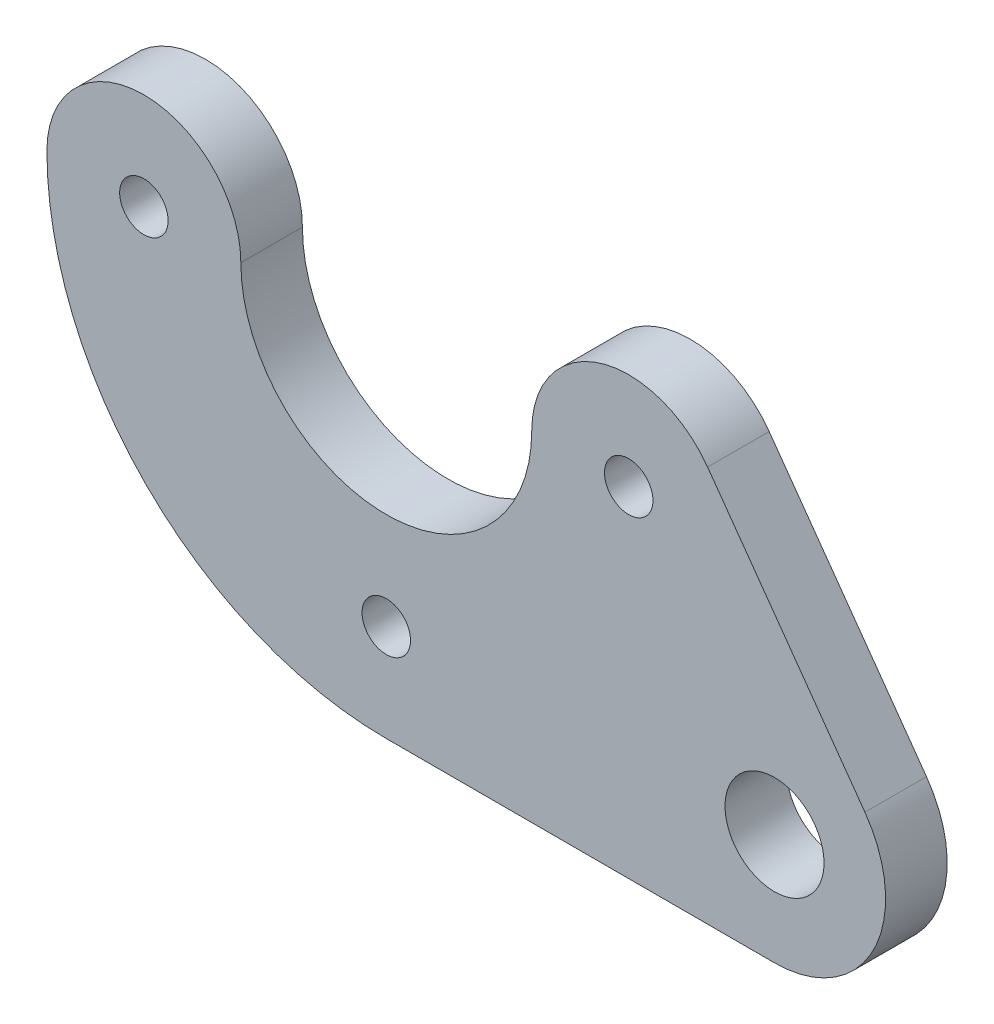
from build123d import *

# Parameters (mm, degrees)
SKETCH1_R           = 1.25
SKETCH1_R_2         = 2.5527
BOSS_EXTRUDE1_DEPTH = 3.175


with BuildPart() as part:
    # Sketch1 → Boss-Extrude1 (new body)
    with BuildSketch(Plane.XY):
        with BuildLine():
            Line((16.568712632, 2.906127581), (24.680172581, -8.450290414))
            ThreePointArc((24.680172581, -8.450290414), (25.11170139, -14.401205395), (20.017275273, -17.507075445))
            Line((20.017275273, -17.507075445), (-0.006184716, -17.499998907))
            ThreePointArc((-0.006184716, -17.499998907), (-12.376555105, -12.37218185), (-17.5, 0))
            ThreePointArc((-17.5, 0), (-12.5, 5), (-7.5, 0))
            ThreePointArc((-7.5, 0), (0, -7.5), (7.5, 0))
            ThreePointArc((7.5, 0), (10.974149935, 4.761489429), (16.568712632, 2.906127581))
        make_face()
        with Locations((12.5, 0)):
            Circle(SKETCH1_R, mode=Mode.SUBTRACT)
        with Locations((0, -12.5)):
            Circle(SKETCH1_R, mode=Mode.SUBTRACT)
        with Locations((-12.5, 0)):
            Circle(SKETCH1_R, mode=Mode.SUBTRACT)
        with Locations((20.019299513, -11.779375803)):
            Circle(SKETCH1_R_2, mode=Mode.SUBTRACT)
    extrude(amount=BOSS_EXTRUDE1_DEPTH)


solid = part.part
